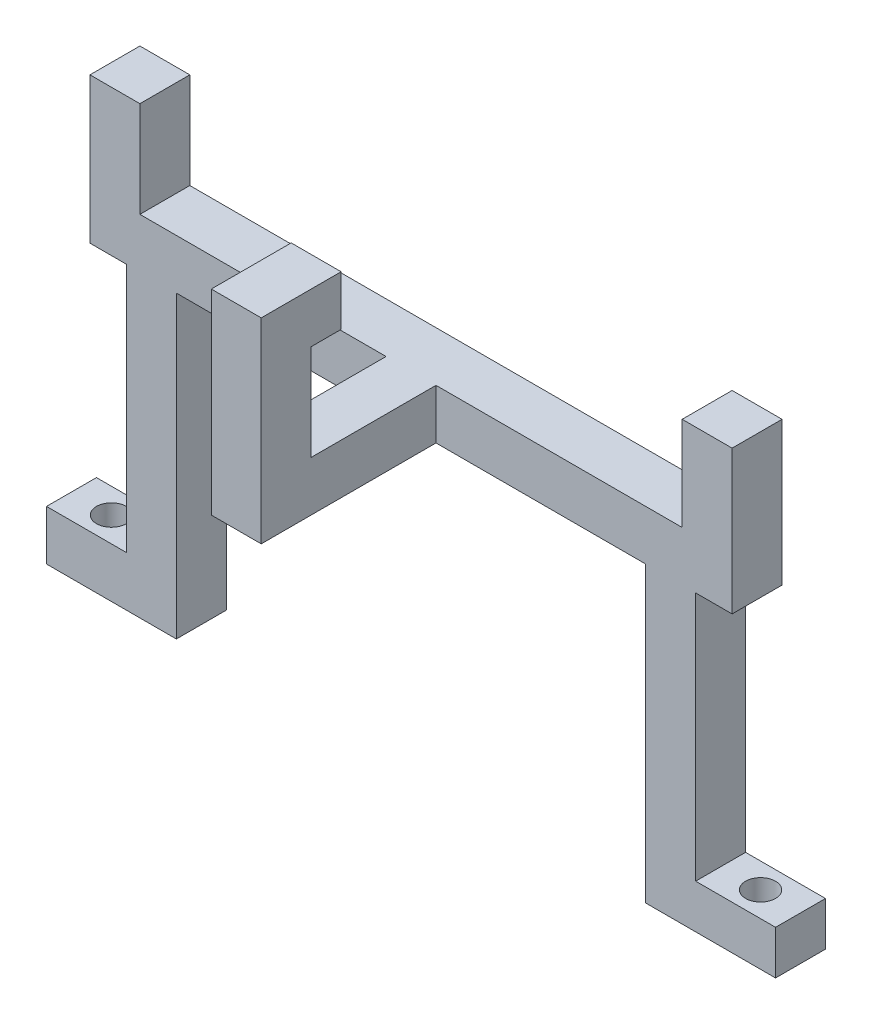
from build123d import *

# Parameters (mm, degrees)
BOSS_EXTRUDE1_DEPTH = 5
SKETCH2_R           = 1.5
CUT_EXTRUDE1_DEPTH  = 41.708230126
SKETCH3_W           = 5
SKETCH3_H           = 5
BOSS_EXTRUDE2_DEPTH = 47
BOSS_EXTRUDE3_DEPTH = 5
SKETCH5_R           = 1.5
CUT_EXTRUDE2_DEPTH  = 77.27686412
BOSS_EXTRUDE4_DEPTH = 12.5
SKETCH10_W          = 5
SKETCH10_H          = 5
BOSS_EXTRUDE5_DEPTH = 14.6
BOSS_EXTRUDE6_DEPTH = 5


with BuildPart() as part:
    # Sketch1 → Boss-Extrude1 (new body)
    with BuildSketch(Plane.XY):
        Polygon((0, 0), (0, 25), (-3.65, 25), (-3.65, 39.6), (1.35, 39.6), (1.35, 30), (5, 30), (5, -5), (-8, -5), (-8, 0), align=None)
    extrude(amount=BOSS_EXTRUDE1_DEPTH)

    # Sketch2 → Cut-Extrude1 (cut, through all)
    with BuildSketch(Plane(origin=(0, 0, 0), x_dir=(1, 0, 0), z_dir=(0, 1, 0))):
        with Locations(Location((-4, -2.5, 0), (0, 0, 270))):
            Circle(SKETCH2_R)
    extrude(amount=-CUT_EXTRUDE1_DEPTH, mode=Mode.SUBTRACT)

    # Sketch3 → Boss-Extrude2 (add)
    with BuildSketch(Plane(origin=(5, 0, 0), x_dir=(0, 0, -1), z_dir=(1, 0, 0))):
        with Locations((-2.5, 27.5)):
            Rectangle(SKETCH3_W, SKETCH3_H)
    extrude(amount=BOSS_EXTRUDE2_DEPTH)

    # Sketch4 → Boss-Extrude3 (add)
    with BuildSketch(Plane(origin=(0, 0, 0), x_dir=(-1, 0, 0), z_dir=(0, 0, -1))):
        Polygon((-52, 30), (-55.65, 30), (-55.65, 39.379320009), (-60.65, 39.379320009), (-60.65, 25), (-57, 25), (-57, 0), (-65, 0), (-65, -4.395887534), (-52, -4.395887534), (-52, 25), align=None)
    extrude(amount=-BOSS_EXTRUDE3_DEPTH)

    # Sketch5 → Cut-Extrude2 (cut, through all)
    with BuildSketch(Plane(origin=(0, 0, 0), x_dir=(1, 0, 0), z_dir=(0, 1, 0))):
        with Locations(Location((61, -2.5, 0), (0, 0, 180))):
            Circle(SKETCH5_R)
    extrude(amount=-CUT_EXTRUDE2_DEPTH, mode=Mode.SUBTRACT)

    # Sketch7 → Boss-Extrude4 (add)
    with BuildSketch(Plane.XY.offset(5)):
        Polygon((28.5, 30), (31, 30), (31, 25), (26, 25), (26, 30), align=None)
    extrude(amount=BOSS_EXTRUDE4_DEPTH)

    # Sketch10 → Boss-Extrude5 (add)
    with BuildSketch(Plane(origin=(0, 25, 0), x_dir=(-1, 0, 0), z_dir=(0, -1, 0))):
        with Locations((-28.5, -20)):
            Rectangle(SKETCH10_W, SKETCH10_H)
    extrude(amount=-BOSS_EXTRUDE5_DEPTH)

    # Sketch11 → Boss-Extrude6 (add)
    with BuildSketch(Plane(origin=(0, 39.6, 0), x_dir=(1, 0, 0), z_dir=(0, 1, 0))):
        Polygon((26, -17.5), (26, -14.5), (31, -14.5), (31, -22.5), (26, -22.5), align=None)
    extrude(amount=BOSS_EXTRUDE6_DEPTH)


solid = part.part
